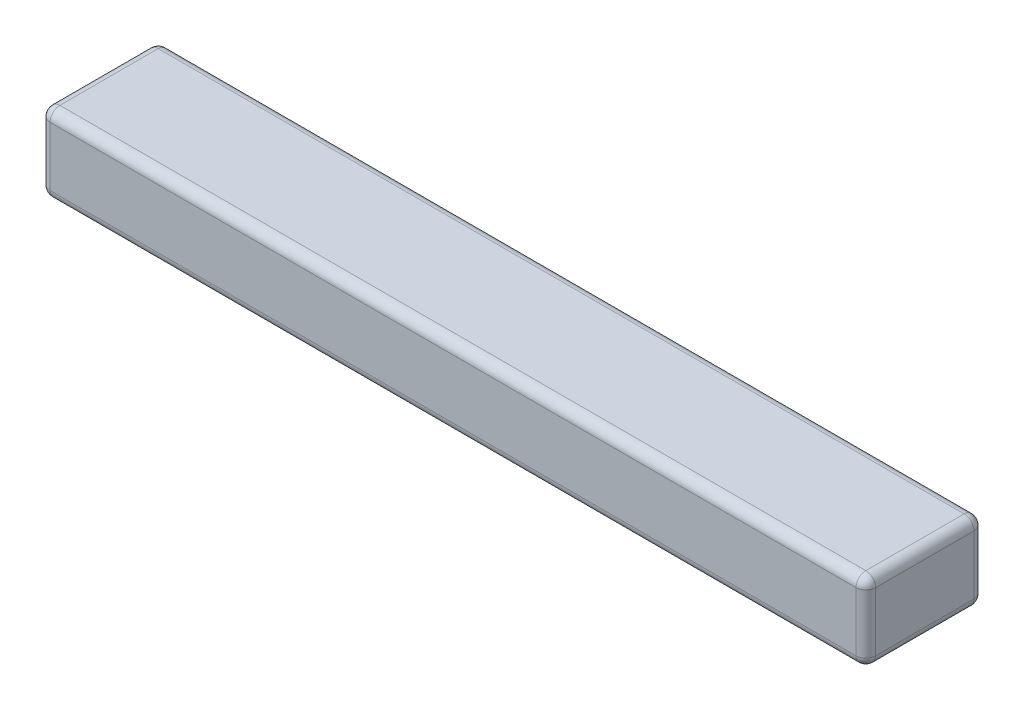
from build123d import *

# Parameters (mm, degrees)
SKETCH1_W           = 60
SKETCH1_H           = 40
BOSS_EXTRUDE1_DEPTH = 210
FILLET1_R           = 5


with BuildPart() as part:
    # Sketch1 → Boss-Extrude1 (new, symmetric)
    with BuildSketch(Plane(origin=(0, 0, 0), x_dir=(0, 0, -1), z_dir=(1, 0, 0))):
        Rectangle(SKETCH1_W, SKETCH1_H)
    extrude(amount=BOSS_EXTRUDE1_DEPTH, both=True)

    # Fillet1
    fillet1_edges = [part.edges().sort_by_distance(p)[0] for p in [
        (210, 0, 30),
        (210, -20, 0),
        (210, 0, -30),
        (-210, -20, 0),
        (-210, 0, 30),
        (-210, 20, 0),
        (-210, 0, -30),
        (210, 20, 0),
        (0, -20, -30),
        (0, -20, 30),
        (0, 20, 30),
        (0, 20, -30),
    ]]
    fillet(fillet1_edges, radius=FILLET1_R)


solid = part.part
